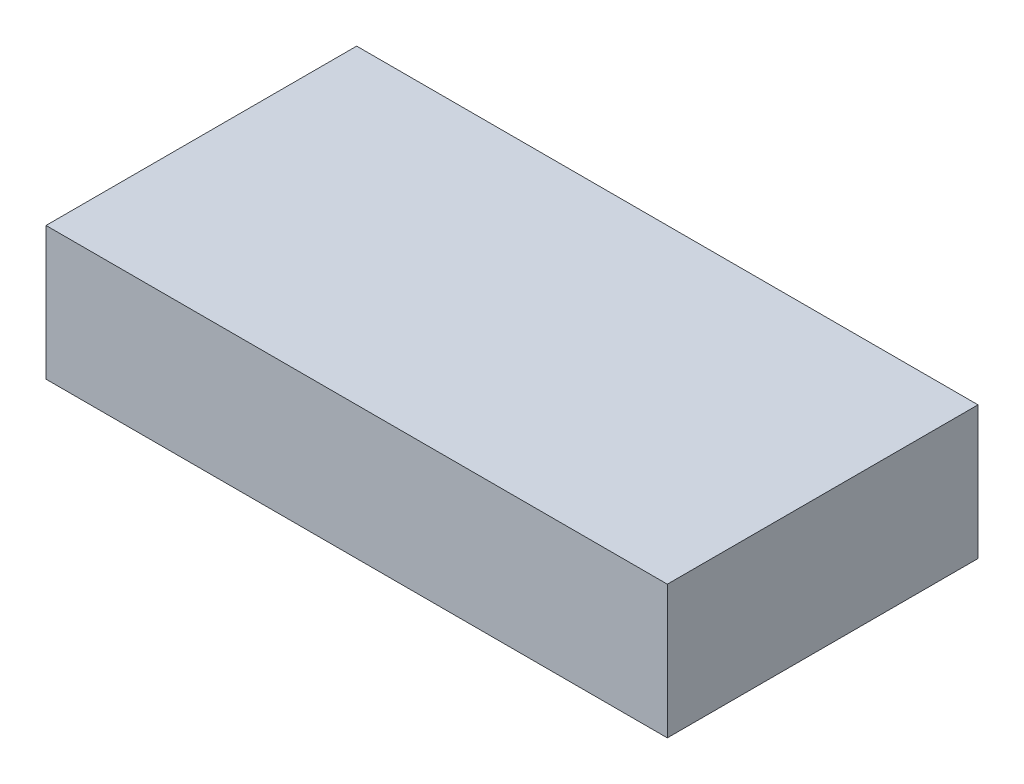
from build123d import *

# Parameters (mm, degrees)
SKETCH2_W           = 88.9
SKETCH2_H           = 44.45
BOSS_EXTRUDE1_DEPTH = 19.05


with BuildPart() as part:
    # Sketch2 → Boss-Extrude1 (new body)
    with BuildSketch(Plane(origin=(0, 0, 0), x_dir=(1, 0, 0), z_dir=(0, 1, 0))):
        Rectangle(SKETCH2_W, SKETCH2_H)
    extrude(amount=BOSS_EXTRUDE1_DEPTH)


solid = part.part
